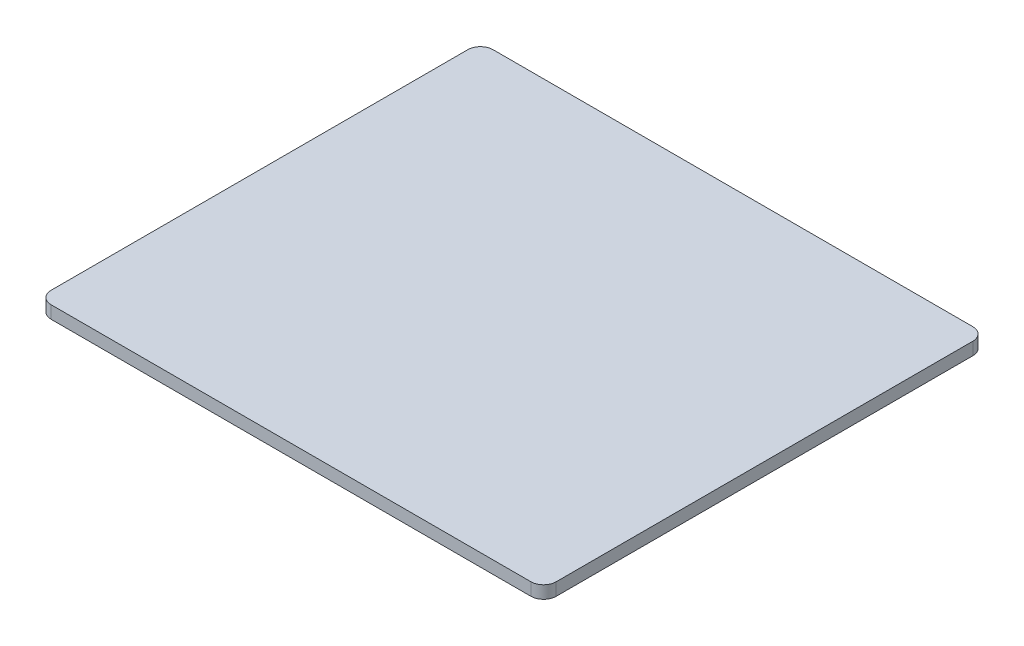
from build123d import *

# Parameters (mm, degrees)
SKETCH1_W           = 400
SKETCH1_H           = 350
BOSS_EXTRUDE1_DEPTH = 10
FILLET1_R           = 10


with BuildPart() as part:
    # Sketch1 → Boss-Extrude1 (new body)
    with BuildSketch(Plane(origin=(0, 0, 0), x_dir=(1, 0, 0), z_dir=(0, 1, 0))):
        Rectangle(SKETCH1_W, SKETCH1_H)
    extrude(amount=BOSS_EXTRUDE1_DEPTH)

    # Fillet1
    fillet1_edges = [part.edges().sort_by_distance(p)[0] for p in [
        (200, 5, 175),
        (-200, 5, 175),
        (-200, 5, -175),
        (200, 5, -175),
    ]]
    fillet(fillet1_edges, radius=FILLET1_R)


solid = part.part
